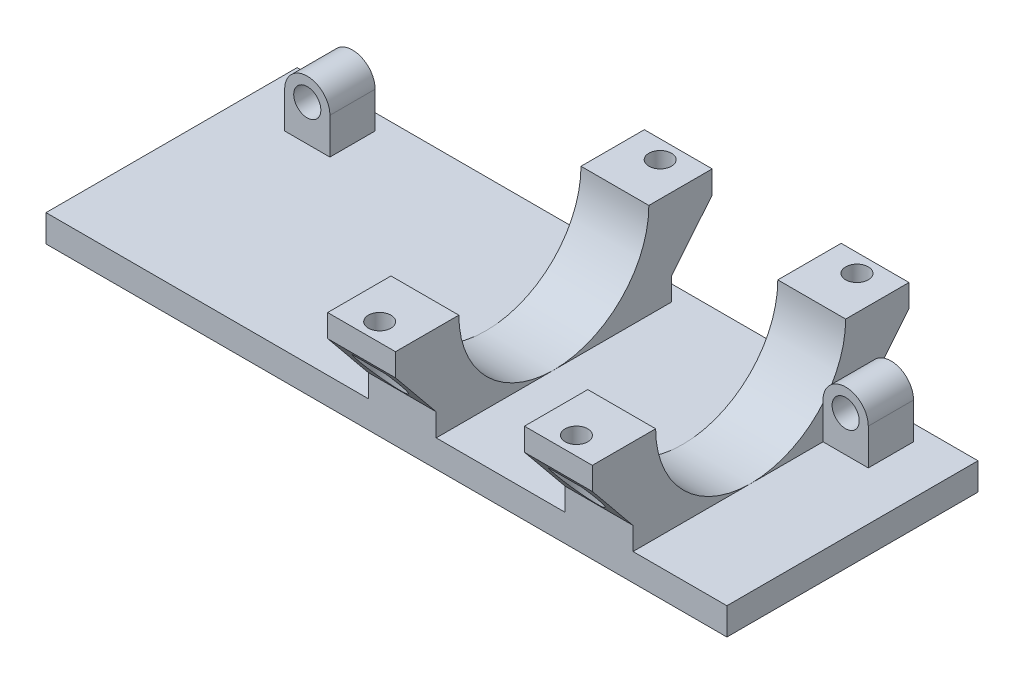
from build123d import *

# Parameters (mm, degrees)
CROQUIS1_W                                 = 149
CROQUIS1_H                                 = 53
SALIENTE_EXTRUIR1_DEPTH                    = 6
SALIENTE_EXTRUIR2_DEPTH                    = 15
SALIENTE_EXTRUIR5_DEPTH                    = 15
CROQUIS3_R                                 = 21
CORTAR_EXTRUIR2_DEPTH                      = 140.238105417
CROQUIS6_R                                 = 3
SALIENTE_EXTRUIR11_DEPTH                   = 10
CROQUIS12_W                                = 53
CROQUIS12_H                                = 6
SALIENTE_EXTRUIR24_DEPTH                   = 3.75
CROQUIS13_W                                = 152.75
CROQUIS13_H                                = 6
SALIENTE_EXTRUIR25_DEPTH                   = 3
CROQUIS14_W                                = 2.25
CROQUIS14_H                                = 56
CORTAR_EXTRUIR3_DEPTH                      = 96.928684448
CROQUIS17_W                                = 150.5
CROQUIS17_H                                = 0.5
CORTAR_EXTRUIR4_DEPTH                      = 96.928684448
CROQUIS18_W                                = 100
CROQUIS18_H                                = 60
CORTAR_EXTRUIR5_DEPTH                      = 88.876689173
SALIENTE_EXTRUIR27_DEPTH                   = 15
CROQUIS20_R                                = 2.5
CORTAR_EXTRUIR6_DEPTH                      = 10
SIMETR_A6_COPY_1_DEPTH                     = 15
SIMETR_A6_COPY_2_SKETCH_R                  = 2.5
SIMETR_A6_COPY_2_DEPTH                     = 10
CROQUIS21_R                                = 4.5
CORTAR_EXTRUIR7_DEPTH                      = 10
SIMETR_A7_AT_THE_SECOND_PLANE_COPY_1_SKE_R = 4.5
SIMETR_A7_AT_THE_SECOND_PLANE_COPY_1_DEPTH = 10


with BuildPart() as part:
    # Croquis1 → Saliente-Extruir1 (new body)
    with BuildSketch(Plane(origin=(0, 0, 0), x_dir=(1, 0, 0), z_dir=(0, 1, 0))):
        Rectangle(CROQUIS1_W, CROQUIS1_H)
    extrude(amount=SALIENTE_EXTRUIR1_DEPTH)

    # Croquis2 → Saliente-Extruir2 (add)
    with BuildSketch(Plane(origin=(51.5, 0, 0), x_dir=(0, 0, -1), z_dir=(1, 0, 0))):
        with BuildLine():
            Line((26, 6), (-26, 6))
            Line((-26, 6), (-26, 27))
            ThreePointArc((-26, 27), (0, 53), (26, 27))
            Line((26, 27), (26, 6))
        make_face()
    extrude(amount=-SALIENTE_EXTRUIR2_DEPTH)

    # Croquis5 → Saliente-Extruir5 (add)
    with BuildSketch(Plane.ZY.offset(-8)):
        with BuildLine():
            Line((-26, 6), (26, 6))
            Line((26, 6), (26, 27))
            ThreePointArc((26, 27), (0, 53), (-26, 27))
            Line((-26, 27), (-26, 6))
        make_face()
    extrude(amount=SALIENTE_EXTRUIR5_DEPTH)

    # Croquis3 → Cortar-Extruir2 (cut, through all)
    with BuildSketch(Plane(origin=(51.5, 0, 0), x_dir=(0, 0, -1), z_dir=(1, 0, 0))):
        with Locations(Location((0, 27, 0), (0, 0, 270))):
            Circle(CROQUIS3_R)
    extrude(amount=-CORTAR_EXTRUIR2_DEPTH, mode=Mode.SUBTRACT)

    # Croquis12 → Saliente-Extruir24 (add)
    with BuildSketch(Plane.ZY.offset(74.5)):
        with Locations((0, 3)):
            Rectangle(CROQUIS12_W, CROQUIS12_H)
    extrude(amount=SALIENTE_EXTRUIR24_DEPTH)

    # Croquis13 → Saliente-Extruir25 (add)
    with BuildSketch(Plane(origin=(0, 0, -26.5), x_dir=(-1, 0, 0), z_dir=(0, 0, -1))):
        with Locations((1.875, 3)):
            Rectangle(CROQUIS13_W, CROQUIS13_H)
    extrude(amount=SALIENTE_EXTRUIR25_DEPTH)

    # Croquis14 → Cortar-Extruir3 (cut, through all)
    with BuildSketch(Plane(origin=(0, 6, 0), x_dir=(1, 0, 0), z_dir=(0, 1, 0))):
        with Locations((73.375, 1.5)):
            Rectangle(CROQUIS14_W, CROQUIS14_H)
    extrude(amount=-CORTAR_EXTRUIR3_DEPTH, mode=Mode.SUBTRACT)

    # Croquis17 → Cortar-Extruir4 (cut, through all)
    with BuildSketch(Plane(origin=(0, 6, 0), x_dir=(1, 0, 0), z_dir=(0, 1, 0))):
        with Locations((-3, -26.25)):
            Rectangle(CROQUIS17_W, CROQUIS17_H)
    extrude(amount=-CORTAR_EXTRUIR4_DEPTH, mode=Mode.SUBTRACT)

    # Croquis18 → Cortar-Extruir5 (cut, through all)
    with BuildSketch(Plane(origin=(0, 27, 0), x_dir=(1, 0, 0), z_dir=(0, 1, 0))):
        with Locations((22.25, 1.75)):
            Rectangle(CROQUIS18_W, CROQUIS18_H)
    extrude(amount=CORTAR_EXTRUIR5_DEPTH, mode=Mode.SUBTRACT)

    # Croquis19 → Saliente-Extruir27 (add)
    with BuildSketch(Plane(origin=(51.5, 0, 0), x_dir=(0, 0, -1), z_dir=(1, 0, 0))):
        Polygon((-26, 27), (-35, 27), (-35, 22), (-26, 11), align=None)
    saliente_extruir27 = extrude(amount=-SALIENTE_EXTRUIR27_DEPTH)

    # Croquis20 → Cortar-Extruir6 (cut)
    with BuildSketch(Plane(origin=(0, 27, 0), x_dir=(1, 0, 0), z_dir=(0, 1, 0))):
        with Locations(Location((44, -31, 0), (0, 0, 270))):
            Circle(CROQUIS20_R)
    cortar_extruir6 = extrude(amount=-CORTAR_EXTRUIR6_DEPTH, mode=Mode.SUBTRACT)

    # Simetría3: Saliente-Extruir27 across plane
    add(saliente_extruir27.mirror(Plane.XY))

    # Simetr_a3 2: Cortar-Extruir6 across plane
    add(cortar_extruir6.mirror(Plane.XY), mode=Mode.SUBTRACT)

    # Simetría6: Saliente-Extruir27, Cortar-Extruir6 across plane
    add(saliente_extruir27.mirror(Plane(origin=(22.25, 0, 0), x_dir=(0, 0, 1), z_dir=(1, 0, 0))))
    add(cortar_extruir6.mirror(Plane(origin=(22.25, 0, 0), x_dir=(0, 0, 1), z_dir=(1, 0, 0))), mode=Mode.SUBTRACT)

    # Simetría6 copy 1 sketch → Simetría6 copy 1 (add)
    with BuildSketch(Plane.ZY.offset(7)):
        Polygon((-26, 27), (-35, 27), (-35, 22), (-26, 11), align=None)
    extrude(amount=-SIMETR_A6_COPY_1_DEPTH)

    # Simetría6 copy 2 sketch → Simetría6 copy 2 (cut)
    with BuildSketch(Plane(origin=(44.5, 27, 0), x_dir=(-1, 0, 0), z_dir=(0, 1, 0))):
        with Locations(Location((44, -31, 0), (0, 0, 270))):
            Circle(SIMETR_A6_COPY_2_SKETCH_R)
    extrude(amount=-SIMETR_A6_COPY_2_DEPTH, mode=Mode.SUBTRACT)

    # Croquis21 → Cortar-Extruir7 (cut)
    with BuildSketch(Plane(origin=(0, 20.17, 0), x_dir=(1, 0, 0), z_dir=(0, 1, 0))):
        with Locations((44, -31)):
            Circle(CROQUIS21_R)
    cortar_extruir7 = extrude(amount=-CORTAR_EXTRUIR7_DEPTH, mode=Mode.SUBTRACT)

    # Simetría7: Cortar-Extruir7 across plane
    add(cortar_extruir7.mirror(Plane.XY), mode=Mode.SUBTRACT)

    # Simetría7 at the second plane: Cortar-Extruir7 across plane
    add(cortar_extruir7.mirror(Plane(origin=(22.25, 0, 0), x_dir=(0, 0, 1), z_dir=(1, 0, 0))), mode=Mode.SUBTRACT)

    # Simetría7 at the second plane copy 1 ske → Simetría7 at the second plane copy 1 (cut)
    with BuildSketch(Plane(origin=(44.5, 20.17, 0), x_dir=(-1, 0, 0), z_dir=(0, 1, 0))):
        with Locations((44, -31)):
            Circle(SIMETR_A7_AT_THE_SECOND_PLANE_COPY_1_SKE_R)
    extrude(amount=-SIMETR_A7_AT_THE_SECOND_PLANE_COPY_1_DEPTH, mode=Mode.SUBTRACT)


with BuildPart() as body_2:
    # Croquis6 → Saliente-Extruir11 (new body)
    with BuildSketch(Plane.XY.offset(-26)):
        with BuildLine():
            Line((61.5, 6), (51.5, 6))
            Line((51.5, 6), (51.5, 14))
            ThreePointArc((51.5, 14), (56.5, 19), (61.5, 14))
            Line((61.5, 14), (61.5, 6))
        make_face()
        with Locations((56.5, 14)):
            Circle(CROQUIS6_R, mode=Mode.SUBTRACT)
    extrude(amount=SALIENTE_EXTRUIR11_DEPTH)


with BuildPart() as body_3:
    # Simetría2: mirrored copy
    add(body_2.part.mirror(Plane(origin=(-3, 0, 0), x_dir=(0, 0, 1), z_dir=(1, 0, 0))))


solid = Compound([part.part, body_2.part, body_3.part])
